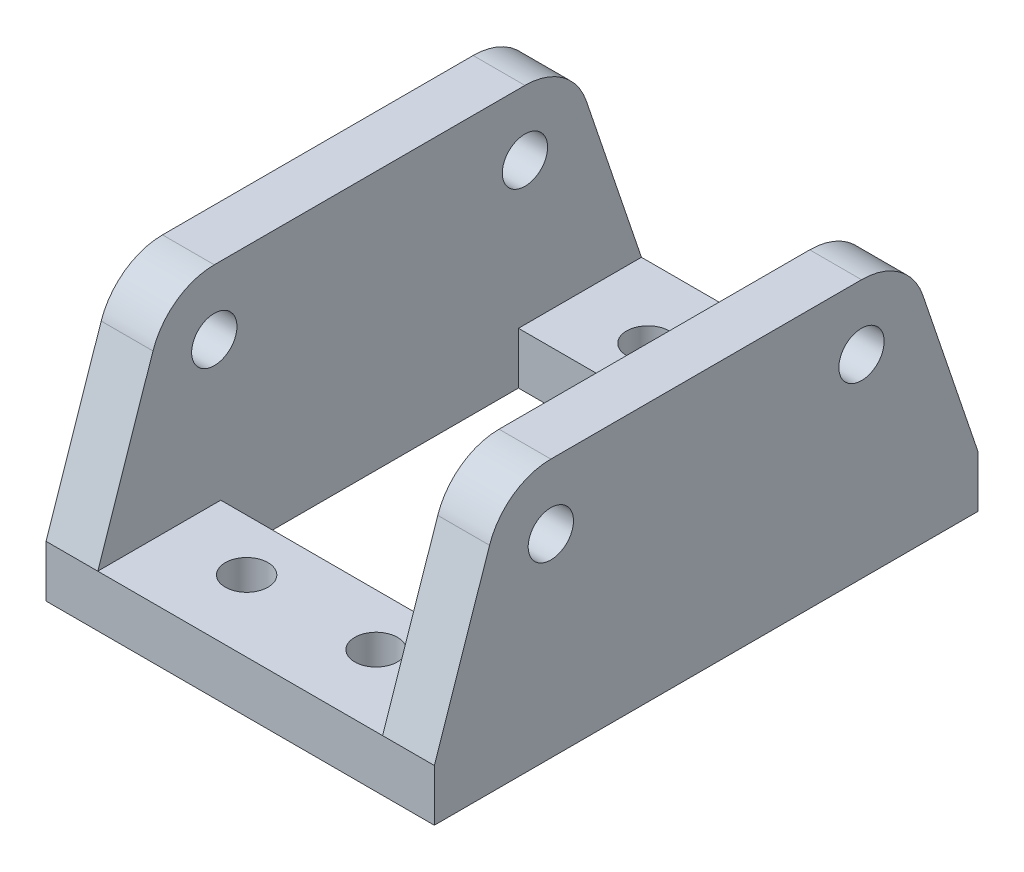
from build123d import *

# Parameters (mm, degrees)
ESBO_O1_W                  = 30
ESBO_O1_H                  = 50
ESBO_O1_W_2                = 22
ESBO_O1_H_2                = 42
RESSALTO_EXTRUS_O1_DEPTH   = 20
ESBO_O3_R                  = 1.75
CORTE_EXTRUS_O2_DEPTH      = 44.874821937
ESBO_O4_W                  = 22
ESBO_O4_H                  = 9.5
ESBO_O4_R                  = 1.65
RESSALTO_EXTRUS_O2_DEPTH   = 4
CORTE_EXTRUS_O3_DEPTH      = 44.874821937
CORTE_EXTRUS_O3_DEPTH_BACK = 44.874821937


with BuildPart() as part:
    # Esboço1 → Ressalto-extrusão1 (new body)
    with BuildSketch(Plane(origin=(0, 0, 0), x_dir=(1, 0, 0), z_dir=(0, 1, 0))):
        Rectangle(ESBO_O1_W, ESBO_O1_H)
        Rectangle(ESBO_O1_W_2, ESBO_O1_H_2, mode=Mode.SUBTRACT)
    extrude(amount=RESSALTO_EXTRUS_O1_DEPTH)

    # Esboço3 → Corte-extrusão2 (cut, through all)
    with BuildSketch(Plane(origin=(15, 0, 0), x_dir=(0, 0, -1), z_dir=(1, 0, 0))):
        with Locations((-12, 15)):
            Circle(ESBO_O3_R)
        with Locations((12, 15)):
            Circle(ESBO_O3_R)
    extrude(amount=-CORTE_EXTRUS_O2_DEPTH, mode=Mode.SUBTRACT)

    # Esboço4 → Ressalto-extrusão2 (add)
    # profile 1 of 2: a face of its own
    with BuildSketch(Plane(origin=(0, 0, 0), x_dir=(1, 0, 0), z_dir=(0, 1, 0))):
        with Locations((0, 16.25)):
            Rectangle(ESBO_O4_W, ESBO_O4_H)
        with Locations(Location((-5, 15.5, 0), (0, 0, 270))):
            Circle(ESBO_O4_R, mode=Mode.SUBTRACT)
        with Locations(Location((5, 15.5, 0), (0, 0, 90))):
            Circle(ESBO_O4_R, mode=Mode.SUBTRACT)
    # profile 2 of 2: a face of its own
    with BuildSketch(Plane(origin=(0, 0, 0), x_dir=(1, 0, 0), z_dir=(0, 1, 0))):
        with Locations((0, -16.25)):
            Rectangle(ESBO_O4_W, ESBO_O4_H)
        with Locations(Location((5, -15.5, 0), (0, 0, 90))):
            Circle(ESBO_O4_R, mode=Mode.SUBTRACT)
        with Locations(Location((-5, -15.5, 0), (0, 0, 270))):
            Circle(ESBO_O4_R, mode=Mode.SUBTRACT)
    extrude(amount=RESSALTO_EXTRUS_O2_DEPTH)

    # Esboço5 → Corte-extrusão3 (cut, two sides: drawn at the far end of the back side and taken through both)
    with BuildSketch(Plane.ZY.offset(15).offset(-CORTE_EXTRUS_O3_DEPTH_BACK)):
        with BuildLine():
            Line((-16.736274298, 16.602406244), (-21, 4))
            Line((-21, 4), (-21, 0))
            Line((-21, 0), (-25, 0))
            Line((-25, 0), (-25, 4))
            Line((-25, 4), (-25, 20))
            Line((-25, 20), (-12, 20))
            ThreePointArc((-12, 20), (-14.914444096, 19.062759605), (-16.736274298, 16.602406244))
        make_face()
        with BuildLine():
            Line((25, 0), (25, 4))
            Line((25, 4), (25, 20))
            Line((25, 20), (12, 20))
            ThreePointArc((12, 20), (14.914444096, 19.062759605), (16.736274298, 16.602406244))
            Line((16.736274298, 16.602406244), (21, 4))
            Line((21, 4), (21, 0))
            Line((21, 0), (25, 0))
        make_face()
    extrude(amount=CORTE_EXTRUS_O3_DEPTH + CORTE_EXTRUS_O3_DEPTH_BACK, mode=Mode.SUBTRACT)


solid = part.part
